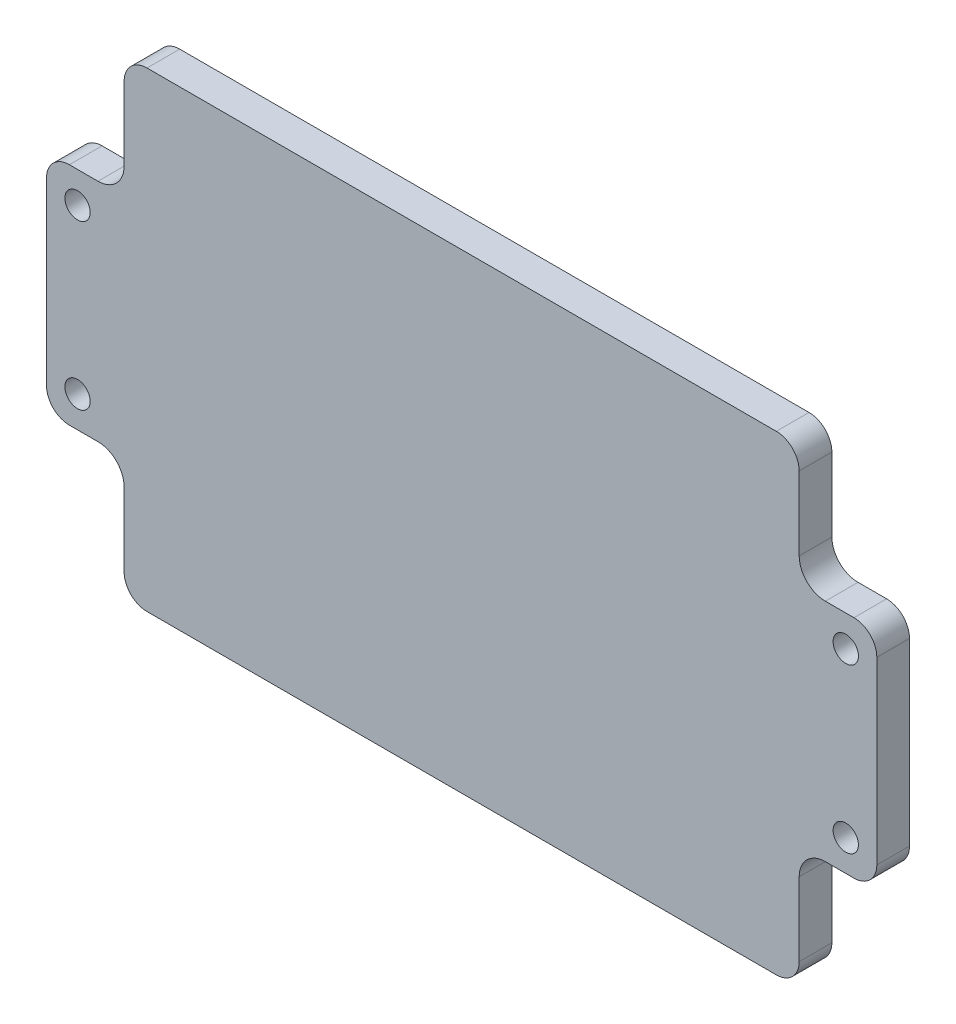
from build123d import *

# Parameters (mm, degrees)
EXTRUDE_1_DEPTH     = 4
SKETCH_3_R          = 1.55
CUT_EXTRUDE_1_DEPTH = 118.132745208
SHELL_1_T           = -2


with BuildPart() as part:
    # 草图1 → 凸台-拉伸1 (new body)
    with BuildSketch(Plane.XY):
        with BuildLine():
            Line((0.2, 40), (0.2, 18))
            ThreePointArc((0.2, 18), (1.020101013, 16.020101013), (3, 15.2))
            Line((3, 15.2), (6.5, 15.2))
            ThreePointArc((6.5, 15.2), (8.7627417, 14.2627417), (9.7, 12))
            Line((9.7, 12), (9.7, 3))
            ThreePointArc((9.7, 3), (10.520101013, 1.020101013), (12.5, 0.2))
            Line((12.5, 0.2), (89.5, 0.2))
            ThreePointArc((89.5, 0.2), (91.479898987, 1.020101013), (92.3, 3))
            Line((92.3, 3), (92.3, 12))
            ThreePointArc((92.3, 12), (93.2372583, 14.2627417), (95.5, 15.2))
            Line((95.5, 15.2), (99, 15.2))
            ThreePointArc((99, 15.2), (100.979898987, 16.020101013), (101.8, 18))
            Line((101.8, 18), (101.8, 40))
            ThreePointArc((101.8, 40), (100.979898987, 41.979898987), (99, 42.8))
            Line((99, 42.8), (95.5, 42.8))
            ThreePointArc((95.5, 42.8), (93.2372583, 43.7372583), (92.3, 46))
            Line((92.3, 46), (92.3, 55))
            ThreePointArc((92.3, 55), (91.479898987, 56.979898987), (89.5, 57.8))
            Line((89.5, 57.8), (12.5, 57.8))
            ThreePointArc((12.5, 57.8), (10.520101013, 56.979898987), (9.7, 55))
            Line((9.7, 55), (9.7, 46))
            ThreePointArc((9.7, 46), (8.7627417, 43.7372583), (6.5, 42.8))
            Line((6.5, 42.8), (3, 42.8))
            ThreePointArc((3, 42.8), (1.020101013, 41.979898987), (0.2, 40))
        make_face()
    extrude(amount=EXTRUDE_1_DEPTH)

    # 草图3 → 切除-拉伸1 (cut, through all)
    with BuildSketch(Plane.XY.offset(4)):
        with Locations((4, 39)):
            Circle(SKETCH_3_R)
        with Locations((4, 19)):
            Circle(SKETCH_3_R)
        with Locations((98, 39)):
            Circle(SKETCH_3_R)
        with Locations((98, 19)):
            Circle(SKETCH_3_R)
    extrude(amount=-CUT_EXTRUDE_1_DEPTH, mode=Mode.SUBTRACT)

    # 抽壳1
    shell_1_openings = [part.faces().sort_by_distance(p)[0] for p in [
        (51, 29, 0),
    ]]
    offset(amount=SHELL_1_T, openings=shell_1_openings, kind=Kind.INTERSECTION)


solid = part.part
